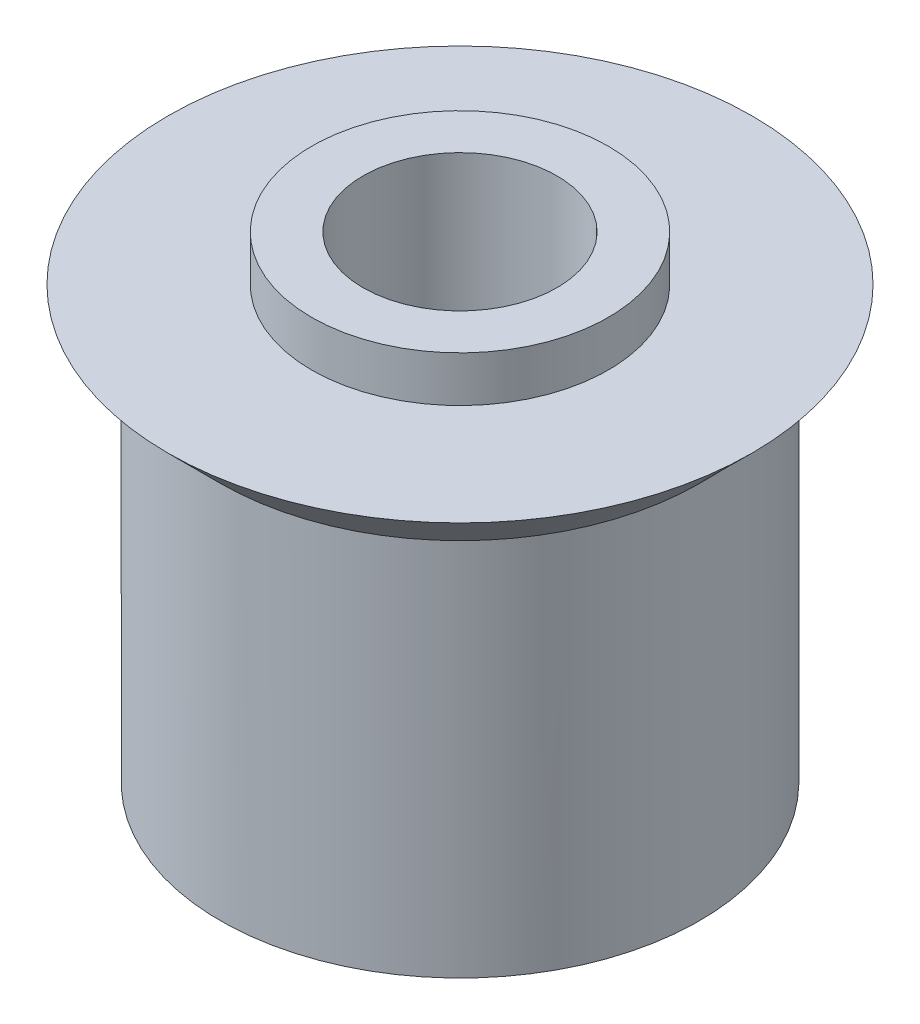
from build123d import *

# Parameters (mm, degrees)
SKETCH_1_R          = 9.4
EXTRUDE_1_DEPTH     = 15.5
SKETCH_3_R          = 6.5
EXTRUDE_2_DEPTH     = 2
SKETCH_5_R          = 10.5
EXTRUDE_4_DEPTH     = 17
SKETCH_4_R          = 4.25
CUT_EXTRUDE_1_DEPTH = 31


with BuildPart() as part:
    # 草图1 → 凸台-拉伸1 (new body)
    with BuildSketch(Plane(origin=(0, 0, 0), x_dir=(1, 0, 0), z_dir=(0, 1, 0))):
        with Locations(Location((0, 0, 0), (0, 0, 270))):
            Circle(SKETCH_1_R)
    extrude(amount=EXTRUDE_1_DEPTH)

    # 草图2 → 旋转1 (revolve)
    with BuildSketch(Plane.XY, mode=Mode.PRIVATE) as revolve_1_sk:
        Polygon((0, 18.9), (12.8, 18.9), (9.4, 15.5), (0, 15.5), align=None)
    revolve(revolve_1_sk.sketch.rotate(Axis((0, 15.5, 0), (0, 1, 0)), 270), axis=Axis((0, 15.5, 0), (0, 1, 0)))

    # 草图3 → 凸台-拉伸2 (add)
    with BuildSketch(Plane(origin=(0, 18.9, 0), x_dir=(1, 0, 0), z_dir=(0, 1, 0))):
        with Locations(Location((0, 0, 0), (0, 0, 270))):
            Circle(SKETCH_3_R)
    extrude(amount=EXTRUDE_2_DEPTH)

    # 草图5 → 凸台-拉伸4 (add)
    with BuildSketch(Plane.XZ):
        with Locations(Location((0, 0, 0), (0, 0, 270))):
            Circle(SKETCH_5_R)
    extrude(amount=-EXTRUDE_4_DEPTH)

    # 草图4 → 切除-拉伸1 (cut)
    with BuildSketch(Plane(origin=(0, 20.9, 0), x_dir=(1, 0, 0), z_dir=(0, 1, 0))):
        with Locations(Location((0, 0, 0), (0, 0, 270))):
            Circle(SKETCH_4_R)
    extrude(amount=-CUT_EXTRUDE_1_DEPTH, mode=Mode.SUBTRACT)


solid = part.part
